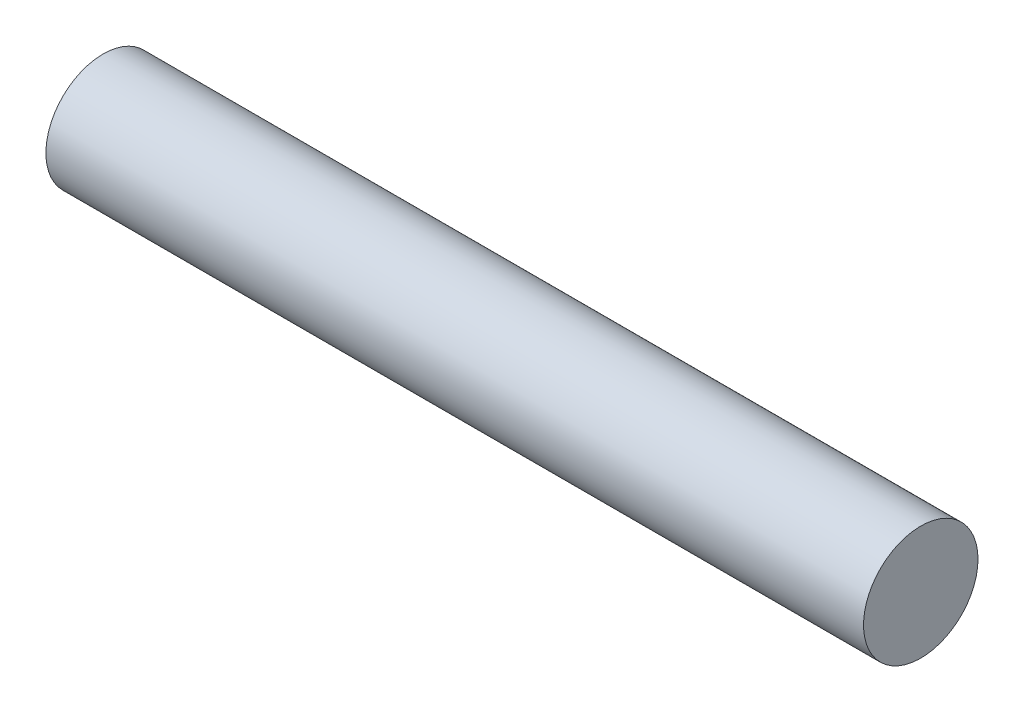
from build123d import *

# Parameters (mm, degrees)
SKETCH1_R           = 3.5
BOSS_EXTRUDE1_DEPTH = 25


with BuildPart() as part:
    # Sketch1 → Boss-Extrude1 (new, symmetric)
    with BuildSketch(Plane(origin=(0, 0, 0), x_dir=(0, 0, -1), z_dir=(1, 0, 0))):
        Circle(SKETCH1_R)
    extrude(amount=BOSS_EXTRUDE1_DEPTH, both=True)


solid = part.part
